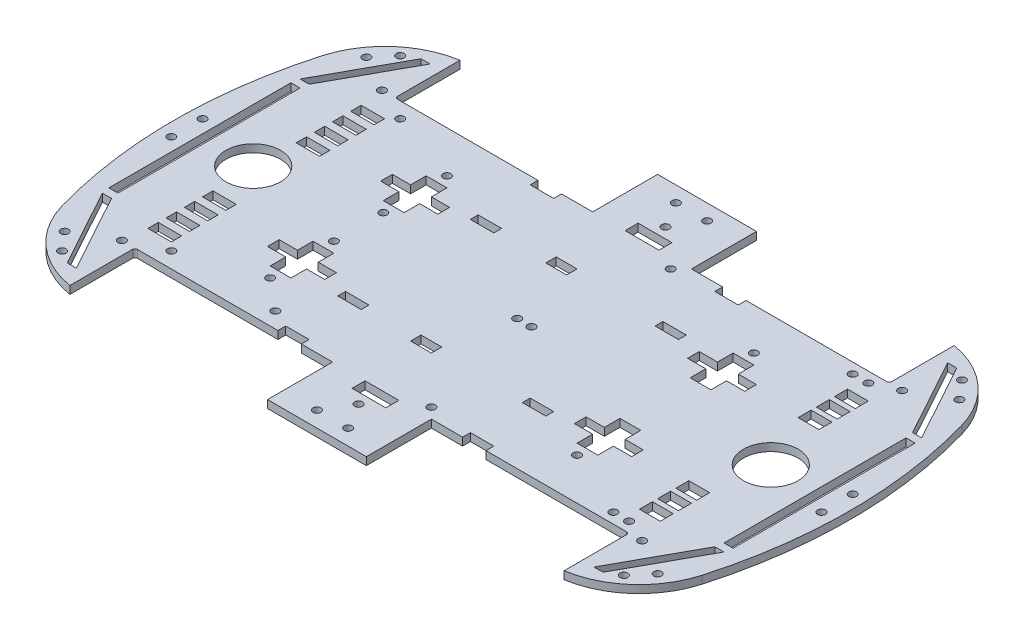
from build123d import *

# Parameters (mm, degrees)
EXTRUDE_1_DEPTH     = 3
SKETCH_2_R          = 10.5
SKETCH_2_W          = 3.5
SKETCH_2_H          = 70
SKETCH_2_W_2        = 9
SKETCH_2_H_2        = 4
SKETCH_2_H_3        = 3
SKETCH_2_W_3        = 13
SKETCH_2_H_4        = 5
SKETCH_2_W_4        = 8
CUT_EXTRUDE_6_DEPTH = 3
SKETCH_3_R          = 1.5
CUT_EXTRUDE_7_DEPTH = 3
FILLET_1_R          = 1


with BuildPart() as part:
    # 草图1 → 凸台-拉伸1 (new body)
    with BuildSketch(Plane(origin=(0, 0, 0), x_dir=(1, 0, 0), z_dir=(0, 1, 0))):
        with BuildLine():
            Line((-95, 50), (-19, 50))
            Line((-19, 50), (-19, 75))
            Line((-19, 75), (19, 75))
            Line((19, 75), (19, 50))
            Line((19, 50), (95, 50))
            Line((95, 50), (95, 75))
            ThreePointArc((95, 75), (112.619816364, 66.554194328), (123, 50))
            ThreePointArc((123, 50), (130, 0), (123, -50))
            ThreePointArc((123, -50), (112.619816364, -66.554194328), (95, -75))
            Line((95, -75), (95, -50))
            Line((95, -50), (19, -50))
            Line((19, -50), (19, -75))
            Line((19, -75), (-19, -75))
            Line((-19, -75), (-19, -50))
            Line((-19, -50), (-95, -50))
            Line((-95, -50), (-95, -75))
            ThreePointArc((-95, -75), (-112.619816364, -66.554194328), (-123, -50))
            ThreePointArc((-123, -50), (-130, 0), (-123, 50))
            ThreePointArc((-123, 50), (-112.619816364, 66.554194328), (-95, 75))
            Line((-95, 75), (-95, 50))
        make_face()
    extrude(amount=EXTRUDE_1_DEPTH)

    # 草图2 → 切除-拉伸6 (cut)
    with BuildSketch(Plane(origin=(0, 0, 0), x_dir=(1, 0, 0), z_dir=(0, 1, 0))):
        with Locations(Location((-99.5, 0, 0), (0, 0, 90))):
            Circle(SKETCH_2_R)
        with Locations(Location((99.5, 0, 0), (0, 0, 90))):
            Circle(SKETCH_2_R)
        Polygon((-119.5, -38), (-116, -38), (-99.5, -68), (-103, -68), align=None)
        with Locations((-118.25, 0)):
            Rectangle(SKETCH_2_W, SKETCH_2_H)
        Polygon((-99.5, 68), (-103, 68), (-119.5, 38), (-116, 38), align=None)
        with Locations((-94.5, 39)):
            Rectangle(SKETCH_2_W_2, SKETCH_2_H_2)
        with Locations((-94.5, 32)):
            Rectangle(SKETCH_2_W_2, SKETCH_2_H_2)
        with Locations((-94.5, 25)):
            Rectangle(SKETCH_2_W_2, SKETCH_2_H_2)
        with Locations((-94.5, 18)):
            Rectangle(SKETCH_2_W_2, SKETCH_2_H_2)
        with Locations((-94.5, -18)):
            Rectangle(SKETCH_2_W_2, SKETCH_2_H_2)
        with Locations((-94.5, -25)):
            Rectangle(SKETCH_2_W_2, SKETCH_2_H_2)
        with Locations((-94.5, -32)):
            Rectangle(SKETCH_2_W_2, SKETCH_2_H_2)
        with Locations((-94.5, -39)):
            Rectangle(SKETCH_2_W_2, SKETCH_2_H_2)
        Polygon((-70, -19.5), (-70, -24), (-63, -24), (-63, -30), (-55, -30), (-55, -24), (-48, -24), (-48, -19.5), (-55, -19.5), (-55, -13.5), (-63, -13.5), (-63, -19.5), align=None)
        Polygon((-63, 19.5), (-70, 19.5), (-70, 24), (-63, 24), (-63, 30), (-55, 30), (-55, 24), (-48, 24), (-48, 19.5), (-55, 19.5), (-55, 13.5), (-63, 13.5), align=None)
        with Locations((-35.5, -48.5)):
            Rectangle(SKETCH_2_W_2, SKETCH_2_H_3)
        with Locations((-35.5, 48.5)):
            Rectangle(SKETCH_2_W_2, SKETCH_2_H_3)
        with Locations((-35.5, 25.5)):
            Rectangle(SKETCH_2_W_2, SKETCH_2_H_3)
        with Locations((-35.5, -25.5)):
            Rectangle(SKETCH_2_W_2, SKETCH_2_H_3)
        with Locations((35.5, 25.5)):
            Rectangle(SKETCH_2_W_2, SKETCH_2_H_3)
        with Locations((35.5, -25.5)):
            Rectangle(SKETCH_2_W_2, SKETCH_2_H_3)
        with Locations((35.5, 48.5)):
            Rectangle(SKETCH_2_W_2, SKETCH_2_H_3)
        with Locations((35.5, -48.5)):
            Rectangle(SKETCH_2_W_2, SKETCH_2_H_3)
        Polygon((70, 19.5), (70, 24), (63, 24), (63, 30), (55, 30), (55, 24), (48, 24), (48, 19.5), (55, 19.5), (55, 13.5), (63, 13.5), (63, 19.5), align=None)
        Polygon((63, -19.5), (70, -19.5), (70, -24), (63, -24), (63, -30), (55, -30), (55, -24), (48, -24), (48, -19.5), (55, -19.5), (55, -13.5), (63, -13.5), align=None)
        Polygon((119.5, 38), (116, 38), (99.5, 68), (103, 68), align=None)
        Polygon((103, -68), (119.5, -38), (116, -38), (99.5, -68), align=None)
        with Locations((118.25, 0)):
            Rectangle(SKETCH_2_W, SKETCH_2_H)
        with Locations((0, -52.5)):
            Rectangle(SKETCH_2_W_3, SKETCH_2_H_4)
        with Locations((0, 52.5)):
            Rectangle(SKETCH_2_W_3, SKETCH_2_H_4)
        with Locations((-7, -26)):
            Rectangle(SKETCH_2_W_4, SKETCH_2_H_2)
        with Locations((-7, 26)):
            Rectangle(SKETCH_2_W_4, SKETCH_2_H_2)
        with Locations((93, -37.5)):
            Rectangle(SKETCH_2_W_4, SKETCH_2_H_4)
        with Locations((93, -30.5)):
            Rectangle(SKETCH_2_W_4, SKETCH_2_H_4)
        with Locations((93, -23.5)):
            Rectangle(SKETCH_2_W_4, SKETCH_2_H_4)
        with Locations((93, 23.5)):
            Rectangle(SKETCH_2_W_4, SKETCH_2_H_4)
        with Locations((93, 30.5)):
            Rectangle(SKETCH_2_W_4, SKETCH_2_H_4)
        with Locations((93, 37.5)):
            Rectangle(SKETCH_2_W_4, SKETCH_2_H_4)
    extrude(amount=CUT_EXTRUDE_6_DEPTH, mode=Mode.SUBTRACT)

    # 草图3 → 切除-拉伸7 (cut)
    with BuildSketch(Plane(origin=(0, 0, 0), x_dir=(1, 0, 0), z_dir=(0, 1, 0))):
        with Locations(Location((-108, -65, 0), (0, 0, 90))):
            Circle(SKETCH_3_R)
        with Locations(Location((-114, -58, 0), (0, 0, 90))):
            Circle(SKETCH_3_R)
        with Locations(Location((-114, 58, 0), (0, 0, 90))):
            Circle(SKETCH_3_R)
        with Locations(Location((-108, 65, 0), (0, 0, 90))):
            Circle(SKETCH_3_R)
        with Locations(Location((-100, 50, 0), (0, 0, 90))):
            Circle(SKETCH_3_R)
        with Locations(Location((-87, 44, 0), (0, 0, 90))):
            Circle(SKETCH_3_R)
        with Locations(Location((-100, -50, 0), (0, 0, 90))):
            Circle(SKETCH_3_R)
        with Locations(Location((-87, -44, 0), (0, 0, 90))):
            Circle(SKETCH_3_R)
        with Locations(Location((-59, -34, 0), (0, 0, 90))):
            Circle(SKETCH_3_R)
        with Locations(Location((-59, -9.5, 0), (0, 0, 90))):
            Circle(SKETCH_3_R)
        with Locations(Location((-59, 34, 0), (0, 0, 90))):
            Circle(SKETCH_3_R)
        with Locations(Location((-59, 9.5, 0), (0, 0, 90))):
            Circle(SKETCH_3_R)
        with Locations(Location((-47, -44, 0), (0, 0, 90))):
            Circle(SKETCH_3_R)
        with Locations(Location((0, -59, 0), (0, 0, 90))):
            Circle(SKETCH_3_R)
        with Locations(Location((-6, -69, 0), (0, 0, 90))):
            Circle(SKETCH_3_R)
        with Locations(Location((6, -69, 0), (0, 0, 90))):
            Circle(SKETCH_3_R)
        with Locations(Location((15, -46, 0), (0, 0, 90))):
            Circle(SKETCH_3_R)
        with Locations(Location((2, 0, 0), (0, 0, 90))):
            Circle(SKETCH_3_R)
        with Locations(Location((7.5, 0, 0), (0, 0, 90))):
            Circle(SKETCH_3_R)
        with Locations(Location((6, 69, 0), (0, 0, 90))):
            Circle(SKETCH_3_R)
        with Locations(Location((-6, 69, 0), (0, 0, 90))):
            Circle(SKETCH_3_R)
        with Locations(Location((0, 59, 0), (0, 0, 90))):
            Circle(SKETCH_3_R)
        with Locations(Location((59, -34, 0), (0, 0, 90))):
            Circle(SKETCH_3_R)
        with Locations(Location((59, 34, 0), (0, 0, 90))):
            Circle(SKETCH_3_R)
        with Locations(Location((85, -46, 0), (0, 0, 90))):
            Circle(SKETCH_3_R)
        with Locations(Location((91, -46, 0), (0, 0, 90))):
            Circle(SKETCH_3_R)
        with Locations(Location((100, -50, 0), (0, 0, 90))):
            Circle(SKETCH_3_R)
        with Locations(Location((114, -58, 0), (0, 0, 90))):
            Circle(SKETCH_3_R)
        with Locations(Location((108, -65, 0), (0, 0, 90))):
            Circle(SKETCH_3_R)
        with Locations(Location((125, 6, 0), (0, 0, 90))):
            Circle(SKETCH_3_R)
        with Locations(Location((125, -6, 0), (0, 0, 90))):
            Circle(SKETCH_3_R)
        with Locations(Location((85, 46, 0), (0, 0, 90))):
            Circle(SKETCH_3_R)
        with Locations(Location((91, 46, 0), (0, 0, 90))):
            Circle(SKETCH_3_R)
        with Locations(Location((108, 65, 0), (0, 0, 90))):
            Circle(SKETCH_3_R)
        with Locations(Location((114, 58, 0), (0, 0, 90))):
            Circle(SKETCH_3_R)
        with Locations(Location((15, 46, 0), (0, 0, 90))):
            Circle(SKETCH_3_R)
        with Locations(Location((-125, 6, 0), (0, 0, 90))):
            Circle(SKETCH_3_R)
        with Locations(Location((-125, -6, 0), (0, 0, 90))):
            Circle(SKETCH_3_R)
        with Locations(Location((100, 50, 0), (0, 0, 90))):
            Circle(SKETCH_3_R)
    extrude(amount=CUT_EXTRUDE_7_DEPTH, mode=Mode.SUBTRACT)

    # 圆角1
    fillet_1_edges = [part.edges().sort_by_distance(p)[0] for p in [
        (95, 1.5, 50),
        (-95, 1.5, 50),
        (-95, 1.5, -50),
        (95, 1.5, -50),
    ]]
    fillet(fillet_1_edges, radius=FILLET_1_R)


solid = part.part
